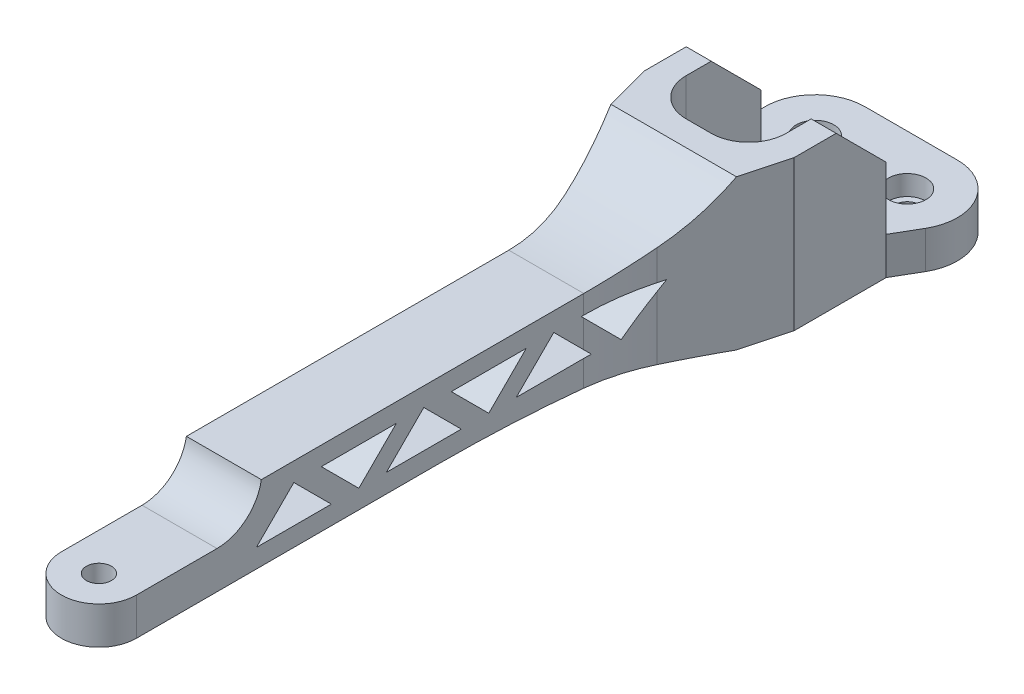
from build123d import *

# Parameters (mm, degrees)
BOSS_EXTRUDE1_DEPTH                      = 30
CUT_EXTRUDE1_DEPTH                       = 306.614135799
CUT_EXTRUDE1_DEPTH_BACK                  = 306.614135799
SKETCH2_R                                = 5
BOSS_EXTRUDE2_START                      = -10
BOSS_EXTRUDE2_DEPTH                      = 15
CBORE_FOR_M10_HEX_HEAD_BOLT1_D           = 10
CBORE_FOR_M10_HEX_HEAD_BOLT1_CBORE_D     = 15
CBORE_FOR_M10_HEX_HEAD_BOLT1_CBORE_DEPTH = 8


with BuildPart() as part:
    # Sketch1 → Boss-Extrude1 (new, symmetric)
    with BuildSketch(Plane(origin=(0, 0, 0), x_dir=(0, 0, -1), z_dir=(1, 0, 0))):
        with BuildLine():
            Line((0, 0), (0, 15))
            Line((0, 15), (47.251760651, 15))
            ThreePointArc((47.251760651, 15), (58.870710689, 19.252272915), (65, 30))
            Line((65, 30), (194.009804864, 30))
            ThreePointArc((194.009804864, 30), (221.395932739, 35.178799781), (245, 50))
            Line((245, 50), (280, 50))
            Line((280, 50), (300, 30))
            Line((300, 30), (300, -10))
            Line((300, -10), (245, -10))
            ThreePointArc((245, -10), (190.685134604, -2.505230148), (135.912878854, 0))
            Line((135.912878854, 0), (0, 0))
        make_face()
        Polygon((63, 7.5), (78, 22.5), (93, 7.5), align=None, mode=Mode.SUBTRACT)
        Polygon((104, 7.5), (89, 22.5), (119, 22.5), align=None, mode=Mode.SUBTRACT)
        Polygon((171, 22.5), (156, 7.5), (141, 22.5), align=None, mode=Mode.SUBTRACT)
        Polygon((145, 7.5), (115, 7.5), (130, 22.5), align=None, mode=Mode.SUBTRACT)
        Polygon((223, 22.5), (208, 7.5), (193, 22.5), align=None, mode=Mode.SUBTRACT)
        Polygon((197, 7.5), (167, 7.5), (182, 22.5), align=None, mode=Mode.SUBTRACT)
    extrude(amount=BOSS_EXTRUDE1_DEPTH, both=True)

    # Sketch2 → Cut-Extrude1 (cut, two sides: drawn at the far end of the back side and taken through both)
    with BuildSketch(Plane(origin=(0, 0, 0), x_dir=(1, 0, 0), z_dir=(0, 1, 0)).offset(-CUT_EXTRUDE1_DEPTH_BACK)):
        with BuildLine():
            ThreePointArc((15, 194), (15.855513863, 207.052619222), (18.407417371, 219.88190451))
            Line((18.407417371, 219.88190451), (30, 263.146011872))
            Line((30, 263.146011872), (30, 300))
            Line((30, 300), (100, 300))
            Line((100, 300), (100, 0))
            Line((100, 0), (0, 0))
            ThreePointArc((0, 0), (10.606601718, 4.393398282), (15, 15))
            Line((15, 15), (15, 194))
        make_face()
        with BuildLine():
            Line((-15, 15), (-15, 194))
            ThreePointArc((-15, 194), (-15.855513863, 207.052619222), (-18.407417371, 219.88190451))
            Line((-18.407417371, 219.88190451), (-30, 263.146011872))
            Line((-30, 263.146011872), (-30, 300))
            Line((-30, 300), (-100, 300))
            Line((-100, 300), (-100, 0))
            Line((-100, 0), (0, 0))
            ThreePointArc((0, 0), (-10.606601718, 4.393398282), (-15, 15))
        make_face()
        with BuildLine():
            Line((-20, 300), (20, 300))
            Line((20, 300), (20, 270))
            ThreePointArc((20, 270), (15.606601718, 259.393398282), (5, 255))
            Line((5, 255), (0, 255))
            Line((0, 255), (-5, 255))
            ThreePointArc((-5, 255), (-15.606601718, 259.393398282), (-20, 270))
            Line((-20, 270), (-20, 300))
        make_face()
        with Locations(Location((0, 15, 0), (0, 0, 270))):
            Circle(SKETCH2_R)
    extrude(amount=CUT_EXTRUDE1_DEPTH + CUT_EXTRUDE1_DEPTH_BACK, mode=Mode.SUBTRACT)

    # Sketch3 → Boss-Extrude2 (add)
    with BuildSketch(Plane(origin=(0, 0, 0), x_dir=(1, 0, 0), z_dir=(0, 1, 0)).offset(BOSS_EXTRUDE2_START)):
        with BuildLine():
            Line((-20, 270), (-20, 280))
            Line((-20, 280), (-20, 300))
            Line((-20, 300), (-30, 300))
            Line((-30, 300), (-35.78511038, 309.938938469))
            ThreePointArc((-35.78511038, 309.938938469), (-35.838126061, 329.969422485), (-18.5, 340))
            Line((-18.5, 340), (0, 340))
            Line((0, 340), (18.5, 340))
            ThreePointArc((18.5, 340), (35.838126061, 329.969422485), (35.78511038, 309.938938469))
            Line((35.78511038, 309.938938469), (30, 300))
            Line((30, 300), (20, 300))
            Line((20, 300), (20, 280))
            Line((20, 280), (20, 270))
            ThreePointArc((20, 270), (15.606601718, 259.393398282), (5, 255))
            Line((5, 255), (-5, 255))
            ThreePointArc((-5, 255), (-15.606601718, 259.393398282), (-20, 270))
        make_face()
    extrude(amount=BOSS_EXTRUDE2_DEPTH)

    # CBORE for M10 Hex Head Bolt1 (through all)
    with Locations(Plane(origin=(0, 5, 0), x_dir=(1, 0, 0), z_dir=(0, 1, 0))):
        with Locations((0, 280), (-18.45, 320), (18.45, 320)):
            CounterBoreHole(CBORE_FOR_M10_HEX_HEAD_BOLT1_D / 2, CBORE_FOR_M10_HEX_HEAD_BOLT1_CBORE_D / 2, CBORE_FOR_M10_HEX_HEAD_BOLT1_CBORE_DEPTH)


solid = part.part
